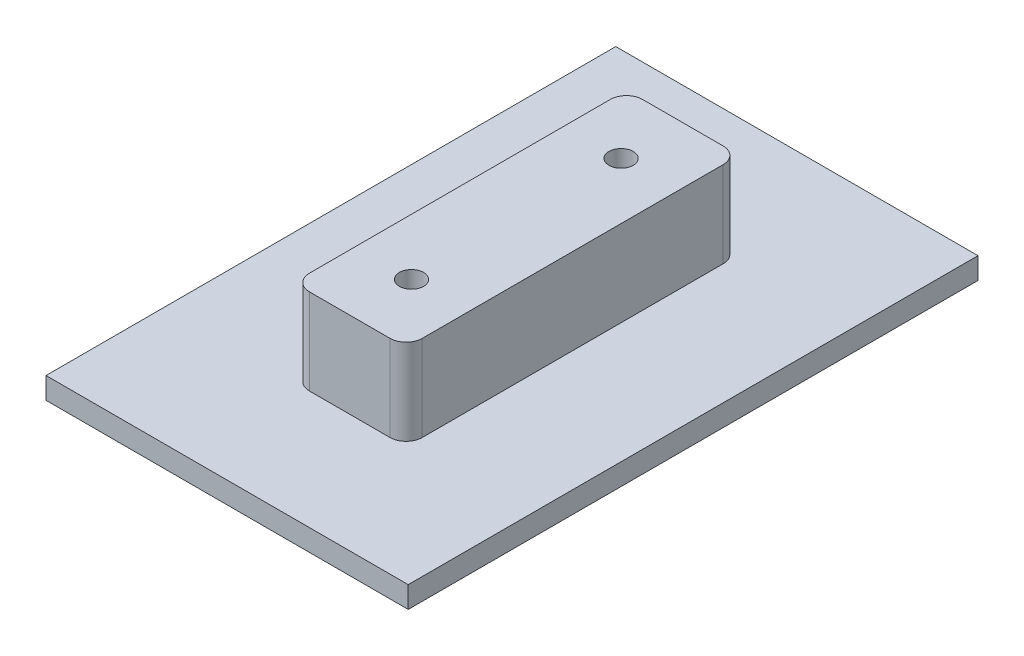
from build123d import *

# Parameters (mm, degrees)
SKETCH1_W      = 214.001476942
SKETCH1_H      = 336.63984765
EXTRUDE1_DEPTH = 12.7
SKETCH2_R      = 7.14375
EXTRUDE2_DEPTH = 50.744786622


with BuildPart() as part:
    # Sketch1 → Extrude1 (new body)
    with BuildSketch(Plane(origin=(0, 0, 0), x_dir=(1, 0, 0), z_dir=(0, 1, 0))):
        Rectangle(SKETCH1_W, SKETCH1_H)
    extrude(amount=-EXTRUDE1_DEPTH)

    # Sketch2 → Extrude2 (add)
    with BuildSketch(Plane(origin=(0, 0, 0), x_dir=(-1, 0, 0), z_dir=(0, 1, 0))):
        with BuildLine():
            Line((-35.873271056, 88.9), (-35.873271056, -88.9))
            ThreePointArc((-35.873271056, -88.9), (-33.083463147, -95.635192091), (-26.348271056, -98.425))
            Line((-26.348271056, -98.425), (21.276728944, -98.425))
            ThreePointArc((21.276728944, -98.425), (28.011921035, -95.635192091), (30.801728944, -88.9))
            Line((30.801728944, -88.9), (30.801728944, 88.9))
            ThreePointArc((30.801728944, 88.9), (28.011921035, 95.635192091), (21.276728944, 98.425))
            Line((21.276728944, 98.425), (-26.348271056, 98.425))
            ThreePointArc((-26.348271056, 98.425), (-33.083463147, 95.635192091), (-35.873271056, 88.9))
        make_face()
        with Locations(Location((-2.535771056, 61.9125, 0), (0, 0, 90))):
            Circle(SKETCH2_R, mode=Mode.SUBTRACT)
        with Locations(Location((-2.535771056, -61.9125, 0), (0, 0, 90))):
            Circle(SKETCH2_R, mode=Mode.SUBTRACT)
    extrude(amount=EXTRUDE2_DEPTH)


solid = part.part
